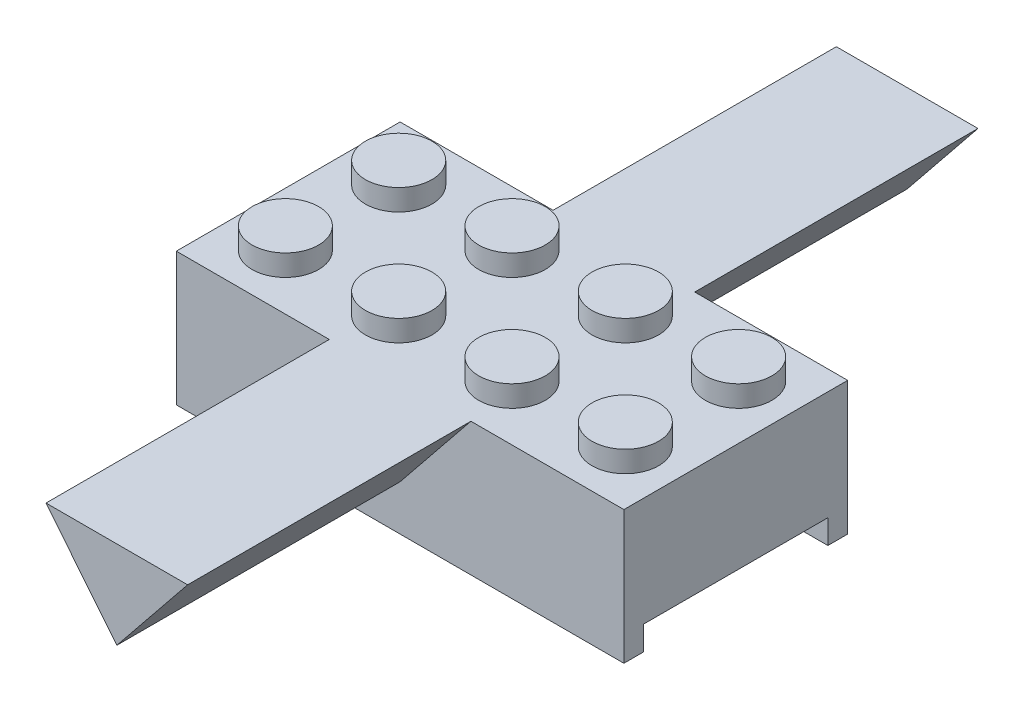
from build123d import *

# Parameters (mm, degrees)
SKETCH1_W           = 31.6
SKETCH1_H           = 15.8
BOSS_EXTRUDE1_DEPTH = 9.4
SKETCH2_W           = 31.6
SKETCH2_H           = 13
CUT_EXTRUDE1_DEPTH  = 1.7
BOSS_EXTRUDE2_DEPTH = 20
BOSS_EXTRUDE3_DEPTH = 20
SKETCH5_R           = 2.35
BOSS_EXTRUDE4_DEPTH = 1.5


with BuildPart() as part:
    # Sketch1 → Boss-Extrude1 (new body)
    with BuildSketch(Plane(origin=(0, 0, 0), x_dir=(1, 0, 0), z_dir=(0, 1, 0))):
        with Locations((-1.354285714, -0.451428571)):
            Rectangle(SKETCH1_W, SKETCH1_H)
    extrude(amount=BOSS_EXTRUDE1_DEPTH)

    # Sketch2 → Cut-Extrude1 (cut)
    with BuildSketch(Plane(origin=(0, 0, 0), x_dir=(-1, 0, 0), z_dir=(0, -1, 0))):
        with Locations((1.354285714, -0.451428571)):
            Rectangle(SKETCH2_W, SKETCH2_H)
    extrude(amount=-CUT_EXTRUDE1_DEPTH, mode=Mode.SUBTRACT)

    # Sketch3 → Boss-Extrude2 (add)
    with BuildSketch(Plane(origin=(0, 0, -7.448571429), x_dir=(-1, 0, 0), z_dir=(0, 0, -1))):
        Polygon((-3.645714286, 9.4), (1.354285714, 3.2), (6.354285714, 9.4), align=None)
    extrude(amount=BOSS_EXTRUDE2_DEPTH)

    # Sketch4 → Boss-Extrude3 (add)
    with BuildSketch(Plane.XY.offset(8.351428571)):
        Polygon((-6.354285714, 9.4), (-1.354285714, 3.2), (3.645714286, 9.4), align=None)
    extrude(amount=BOSS_EXTRUDE3_DEPTH)

    # Sketch5 → Boss-Extrude4 (add)
    with BuildSketch(Plane(origin=(0, 9.4, 0), x_dir=(1, 0, 0), z_dir=(0, 1, 0))):
        with Locations(Location((10.645714286, -4.451428571, 0), (0, 0, 270))):
            Circle(SKETCH5_R)
        with Locations(Location((2.645714286, -4.451428571, 0), (0, 0, 270))):
            Circle(SKETCH5_R)
        with Locations(Location((-5.354285714, -4.451428571, 0), (0, 0, 270))):
            Circle(SKETCH5_R)
        with Locations(Location((-13.354285714, -4.451428571, 0), (0, 0, 270))):
            Circle(SKETCH5_R)
        with Locations(Location((2.645714286, 3.548571429, 0), (0, 0, 270))):
            Circle(SKETCH5_R)
        with Locations(Location((-5.354285714, 3.548571429, 0), (0, 0, 270))):
            Circle(SKETCH5_R)
        with Locations(Location((-13.354285714, 3.548571429, 0), (0, 0, 270))):
            Circle(SKETCH5_R)
        with Locations(Location((10.645714286, 3.548571429, 0), (0, 0, 270))):
            Circle(SKETCH5_R)
    extrude(amount=BOSS_EXTRUDE4_DEPTH)


solid = part.part
